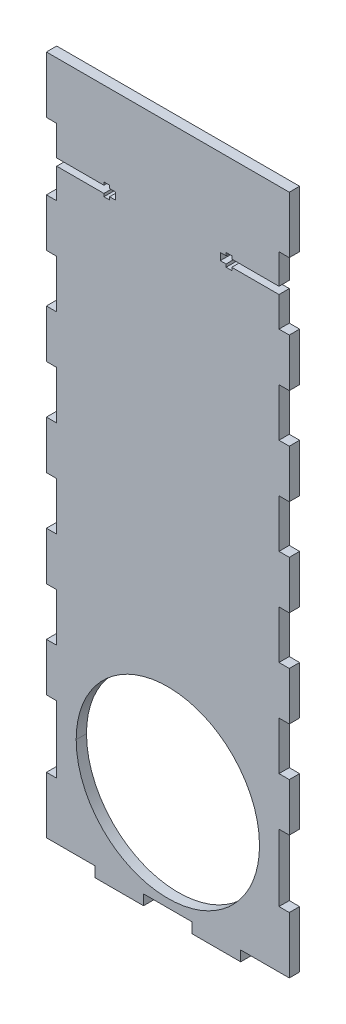
from build123d import *

# Parameters (mm, degrees)
BOSS_EXTRUDE1_DEPTH = 4.5


with BuildPart() as part:
    # Model → Boss-Extrude1 (new body)
    with BuildSketch(Plane.XY):
        with BuildLine():
            Line((1024.025694188, -784.077715082), (1024.025694188, -771.002535918))
            Line((1024.025694188, -771.002535918), (1019.525696134, -771.002535918))
            Line((1019.525696134, -771.002535918), (1019.525696134, -750.002627312))
            Line((1019.525696134, -750.002627312), (1024.025694188, -750.002627312))
            Line((1024.025694188, -750.002627312), (1024.025694188, -729.002718707))
            Line((1024.025694188, -729.002718707), (1019.525696134, -729.002718707))
            Line((1019.525696134, -729.002718707), (1019.525696134, -708.002774823))
            Line((1019.525696134, -708.002774823), (1024.025694188, -708.002774823))
            Line((1024.025694188, -708.002774823), (1024.025694188, -687.002513439))
            Line((1024.025694188, -687.002513439), (1019.525696134, -687.002513439))
            Line((1019.525696134, -687.002513439), (1019.525696134, -666.002569556))
            Line((1019.525696134, -666.002569556), (1024.025694188, -666.002569556))
            Line((1024.025694188, -666.002569556), (1024.025694188, -645.00266095))
            Line((1024.025694188, -645.00266095), (1019.525696134, -645.00266095))
            Line((1019.525696134, -645.00266095), (1019.525696134, -624.002752344))
            Line((1019.525696134, -624.002752344), (1024.025694188, -624.002752344))
            Line((1024.025694188, -624.002752344), (1024.025694188, -603.00280846))
            Line((1024.025694188, -603.00280846), (1019.525696134, -603.00280846))
            Line((1019.525696134, -603.00280846), (1019.525696134, -582.002547077))
            Line((1019.525696134, -582.002547077), (1024.025694188, -582.002547077))
            Line((1024.025694188, -582.002547077), (1024.025694188, -568.927720691))
            Line((1024.025694188, -568.927720691), (1044.62562335, -568.927720691))
            Line((1044.62562335, -568.927720691), (1044.62562335, -570.177612357))
            Line((1044.62562335, -570.177612357), (1047.125724183, -570.177612357))
            Line((1047.125724183, -570.177612357), (1047.125724183, -568.927720691))
            Line((1047.125724183, -568.927720691), (1049.625825015, -568.927720691))
            Line((1049.625825015, -568.927720691), (1049.625825015, -565.827474303))
            Line((1049.625825015, -565.827474303), (1047.125724183, -565.827474303))
            Line((1047.125724183, -565.827474303), (1047.125724183, -564.577582637))
            Line((1047.125724183, -564.577582637), (1044.62562335, -564.577582637))
            Line((1044.62562335, -564.577582637), (1044.62562335, -565.827474303))
            Line((1044.62562335, -565.827474303), (1024.025694188, -565.827474303))
            Line((1024.025694188, -565.827474303), (1024.025694188, -552.752647917))
            Line((1024.025694188, -552.752647917), (1019.525696134, -552.752647917))
            Line((1019.525696134, -552.752647917), (1019.525696134, -528.002746812))
            Line((1019.525696134, -528.002746812), (1040.725770851, -528.002746812))
            add(Edge.make_bspline(
                [(1072.525724176, -528.002746812), (1054.962964736, -528.002746812), (1040.725770851, -528.002746812)],
                knots=[3, 3, 3, 4, 4, 4], degree=2))
            add(Edge.make_bspline(
                [(1104.325677502, -528.002746812), (1090.088483616, -528.002746812), (1072.525724176, -528.002746812)],
                knots=[2, 2, 2, 3, 3, 3], degree=2))
            Line((1104.325677502, -528.002746812), (1125.525787496, -528.002746812))
            Line((1125.525787496, -528.002746812), (1125.525787496, -552.752647917))
            Line((1125.525787496, -552.752647917), (1121.025789442, -552.752647917))
            Line((1121.025789442, -552.752647917), (1121.025789442, -565.827474303))
            Line((1121.025789442, -565.827474303), (1100.425825003, -565.827474303))
            Line((1100.425825003, -565.827474303), (1100.425825003, -564.577582637))
            Line((1100.425825003, -564.577582637), (1097.92572417, -564.577582637))
            Line((1097.92572417, -564.577582637), (1097.92572417, -565.827474303))
            Line((1097.92572417, -565.827474303), (1095.425623337, -565.827474303))
            Line((1095.425623337, -565.827474303), (1095.425623337, -568.927720691))
            Line((1095.425623337, -568.927720691), (1097.92572417, -568.927720691))
            Line((1097.92572417, -568.927720691), (1097.92572417, -570.177612357))
            Line((1097.92572417, -570.177612357), (1100.425825003, -570.177612357))
            Line((1100.425825003, -570.177612357), (1100.425825003, -568.927720691))
            Line((1100.425825003, -568.927720691), (1121.025789442, -568.927720691))
            Line((1121.025789442, -568.927720691), (1121.025789442, -582.002547077))
            Line((1121.025789442, -582.002547077), (1125.525787496, -582.002547077))
            Line((1125.525787496, -582.002547077), (1125.525787496, -603.00280846))
            Line((1125.525787496, -603.00280846), (1121.025789442, -603.00280846))
            Line((1121.025789442, -603.00280846), (1121.025789442, -624.002752344))
            Line((1121.025789442, -624.002752344), (1125.525787496, -624.002752344))
            Line((1125.525787496, -624.002752344), (1125.525787496, -645.00266095))
            Line((1125.525787496, -645.00266095), (1121.025789442, -645.00266095))
            Line((1121.025789442, -645.00266095), (1121.025789442, -666.002569556))
            Line((1121.025789442, -666.002569556), (1125.525787496, -666.002569556))
            Line((1125.525787496, -666.002569556), (1125.525787496, -687.002513439))
            Line((1125.525787496, -687.002513439), (1121.025789442, -687.002513439))
            Line((1121.025789442, -687.002513439), (1121.025789442, -708.002774823))
            Line((1121.025789442, -708.002774823), (1125.525787496, -708.002774823))
            Line((1125.525787496, -708.002774823), (1125.525787496, -729.002718707))
            Line((1125.525787496, -729.002718707), (1121.025789442, -729.002718707))
            Line((1121.025789442, -729.002718707), (1121.025789442, -750.002627312))
            Line((1121.025789442, -750.002627312), (1125.525787496, -750.002627312))
            Line((1125.525787496, -750.002627312), (1125.525787496, -771.002535918))
            Line((1125.525787496, -771.002535918), (1121.025789442, -771.002535918))
            Line((1121.025789442, -771.002535918), (1121.025789442, -784.077715082))
            Line((1121.025789442, -784.077715082), (1121.025789442, -787.177608692))
            Line((1121.025789442, -787.177608692), (1121.025789442, -800.252787855))
            Line((1121.025789442, -800.252787855), (1125.525787496, -800.252787855))
            Line((1125.525787496, -800.252787855), (1125.525787496, -825.00268896))
            Line((1125.525787496, -825.00268896), (1104.325677502, -825.00268896))
            Line((1104.325677502, -825.00268896), (1104.325677502, -829.502687015))
            Line((1104.325677502, -829.502687015), (1083.125955563, -829.502687015))
            Line((1083.125955563, -829.502687015), (1083.125955563, -825.00268896))
            Line((1083.125955563, -825.00268896), (1074.07568862, -825.00268896))
            Line((1074.07568862, -825.00268896), (1070.97579501, -825.00268896))
            Line((1070.97579501, -825.00268896), (1061.925528068, -825.00268896))
            Line((1061.925528068, -825.00268896), (1061.925528068, -829.502687015))
            Line((1061.925528068, -829.502687015), (1040.725770851, -829.502687015))
            Line((1040.725770851, -829.502687015), (1040.725770851, -825.00268896))
            Line((1040.725770851, -825.00268896), (1019.525696134, -825.00268896))
            Line((1019.525696134, -825.00268896), (1019.525696134, -800.252787855))
            Line((1019.525696134, -800.252787855), (1024.025694188, -800.252787855))
            Line((1024.025694188, -800.252787855), (1024.025694188, -787.177608692))
            Line((1024.025694188, -787.177608692), (1024.025694188, -784.077715082))
        make_face()
        with BuildLine():
            add(Edge.make_bspline(
                [(1032.525768909, -781.405176471), (1032.525768909, -759.313702866), (1050.434391682, -741.405044815), (1072.525724176, -741.405044815), (1094.617056671, -741.405044815), (1112.525714722, -759.313702866), (1112.525714722, -781.405176471)],
                knots=[2, 2, 2, 2, 3, 3, 3, 4, 4, 4, 4], degree=3))
            add(Edge.make_bspline(
                [(1112.525714722, -781.405176471), (1112.525714722, -803.496685355), (1094.617056671, -821.405343406), (1072.525724176, -821.405343406), (1050.434391682, -821.405343406), (1032.525768909, -803.496685355), (1032.525768909, -781.405176471)],
                knots=[0, 0, 0, 0, 1, 1, 1, 2, 2, 2, 2], degree=3))
        make_face(mode=Mode.SUBTRACT)
    extrude(amount=BOSS_EXTRUDE1_DEPTH)


solid = part.part
